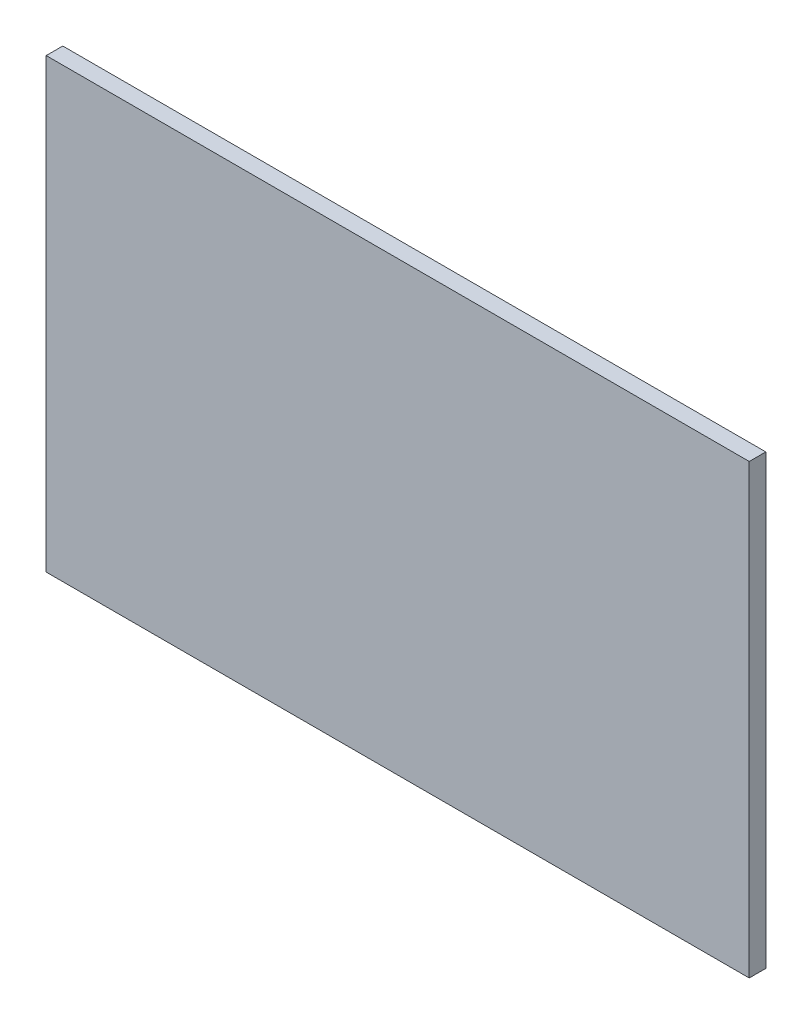
from build123d import *

# Parameters (mm, degrees)
SKETCH1_W           = 63.65
SKETCH1_H           = 40.5
BOSS_EXTRUDE1_DEPTH = 1.5


with BuildPart() as part:
    # Sketch1 → Boss-Extrude1 (new body)
    with BuildSketch(Plane.XY):
        with Locations((31.825, 20.25)):
            Rectangle(SKETCH1_W, SKETCH1_H)
    extrude(amount=BOSS_EXTRUDE1_DEPTH)


solid = part.part
